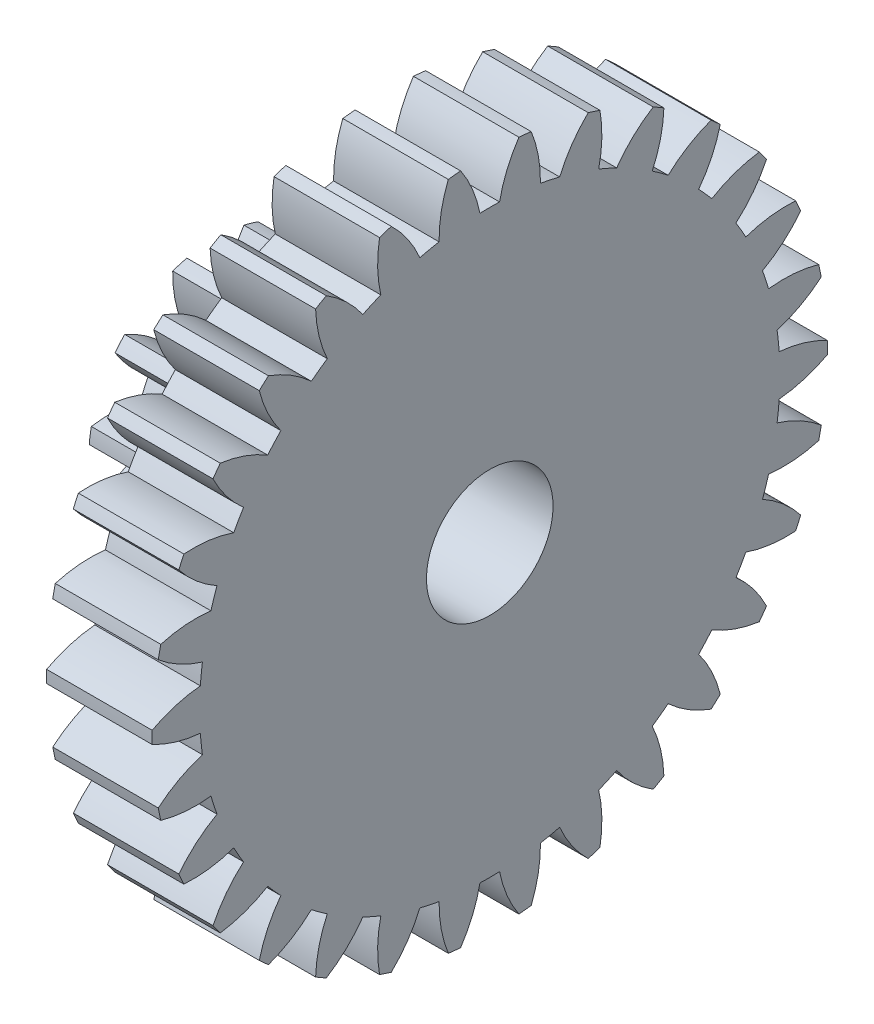
from build123d import *

# Parameters (mm, degrees)
BASPROSKE_W        = 2.5
BASPROSKE_H        = 8
TOOTHCUT_DEPTH     = 12.586630226
TEETHCUTS_COUNT    = 30
HUBNEAONESKE_R     = 3
HUBNEARONE_DEPTH   = 4.0000508
BORSKE_R           = 1.5
BORE_DEPTH         = 6.5000508
CUT_EXTRUDE1_DEPTH = 4.0000508
CIRPATTERN1_COUNT  = 11


with BuildPart() as part:
    # BasProSke → Base-Revolve (revolve)
    with BuildSketch(Plane(origin=(0, 0, 0), x_dir=(1, 0, 0), z_dir=(0, 1, 0)), mode=Mode.PRIVATE) as base_revolve_sk:
        with Locations((1.25, 4)):
            Rectangle(BASPROSKE_W, BASPROSKE_H)
    revolve(base_revolve_sk.sketch.rotate(Axis((-10, 0, 0), (1, 0, 0)), 180), axis=Axis((-10, 0, 0), (1, 0, 0)))

    # TooCutSke → ToothCut (cut, through all)
    with BuildSketch(Plane(origin=(0, 0, 0), x_dir=(0, 0, -1), z_dir=(1, 0, 0))):
        with BuildLine():
            ThreePointArc((0.233102578, 6.87004652), (0, 6.874), (-0.233102578, 6.87004652))
            ThreePointArc((-0.233102578, 6.87004652), (-0.41229689, 7.456465027), (-0.706981715, 7.994199273))
            ThreePointArc((-0.706981715, 7.994199273), (0, 8.0254), (0.706981715, 7.994199273))
            ThreePointArc((0.706981715, 7.994199273), (0.41229689, 7.456465027), (0.233102578, 6.87004652))
        make_face()
    toothcut = extrude(amount=TOOTHCUT_DEPTH, mode=Mode.SUBTRACT)

    # TeethCuts: ToothCut ×30 about axis
    teethcuts_axis = Axis((0, 0, 0), (1, 0, 0))
    for i in range(1, TEETHCUTS_COUNT):
        add(toothcut.rotate(teethcuts_axis, i * 360 / TEETHCUTS_COUNT), mode=Mode.SUBTRACT)

    # HubNeaOneSke → HubNearOne (add)
    with BuildSketch(Plane.ZY):
        with Locations(Location((0, 0, 0), (0, 0, 180))):
            Circle(HUBNEAONESKE_R)
    extrude(amount=HUBNEARONE_DEPTH)

    # BorSke → Bore (cut, symmetric)
    with BuildSketch(Plane(origin=(0, 0, 0), x_dir=(0, 0, -1), z_dir=(1, 0, 0))):
        with Locations(Location((0, 0, 0), (0, 0, 180))):
            Circle(BORSKE_R)
    extrude(amount=BORE_DEPTH, both=True, mode=Mode.SUBTRACT)

    # Sketch2 → Cut-Extrude1 (cut)
    with BuildSketch(Plane.ZY.offset(4.0000508)):
        with BuildLine():
            ThreePointArc((0.233102578, 1.84464652), (0, 1.8486), (-0.233102578, 1.84464652))
            ThreePointArc((-0.233102578, 1.84464652), (-0.41229689, 2.431065027), (-0.706981715, 2.968799273))
            ThreePointArc((-0.706981715, 2.968799273), (0, 3), (0.706981715, 2.968799273))
            ThreePointArc((0.706981715, 2.968799273), (0.41229689, 2.431065027), (0.233102578, 1.84464652))
        make_face()
    cut_extrude1 = extrude(amount=-CUT_EXTRUDE1_DEPTH, mode=Mode.SUBTRACT)

    # CirPattern1: Cut-Extrude1 ×11 about axis
    cirpattern1_axis = Axis((0, 0, 0), (1, 0, 0))
    for i in range(1, CIRPATTERN1_COUNT):
        add(cut_extrude1.rotate(cirpattern1_axis, i * 360 / CIRPATTERN1_COUNT), mode=Mode.SUBTRACT)


solid = part.part
